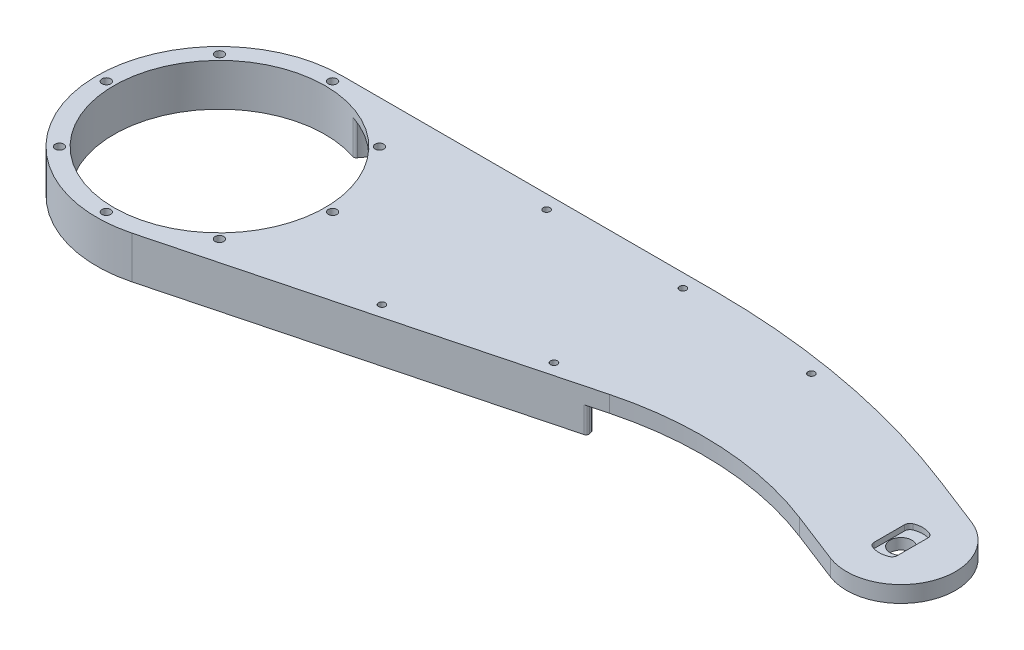
from build123d import *

# Parameters (mm, degrees)
EXTRUDE_1_DEPTH             = 9.500000000000002
EXTRUDE_2_DEPTH             = 115.05569061587602
EXTRUDE_3_DEPTH             = 5.999999999999999
CUT_EXTRUDE_1_DEPTH         = 3.000000000000001
EXTRUDE_4_DEPTH             = 12.5
EXTRUDE_5_DEPTH             = 12.5
EXTRUDE_START               = 12.5
EXTRUDE_6_DEPTH             = 12.5
EXTRUDE_7_DEPTH             = 12.5
CUT_EXTRUDE_2_DEPTH         = 2
HOLE_WIZARD_8_0_8_1_D       = 8
HOLE_WIZARD_8_0_8_1_DEPTH   = 6
HOLE_WIZARD_2_5_2_5_1_D     = 2.5
HOLE_WIZARD_3_2_3_2_1_D     = 3.2
HOLE_WIZARD_3_2_3_2_1_DEPTH = 15.5
HOLE_WIZARD_3_2_3_2_2_D     = 3.2
FILLET_1_R                  = 1
FILLET_2_R                  = 2
FILLET_3_R                  = 120.00000000000003


with BuildPart() as part:
    # Эскиз1 → Бобышка-Вытянуть1 (new body)
    with BuildSketch(Plane.XZ):
        with BuildLine():
            Line((31.779364408196322, 35.09465055833703), (32.53928446481828, 37.996808635931096))
            Line((32.53928446481828, 37.996808635931096), (11.398800849455474, 43.53237116439277))
            ThreePointArc((11.398800849455474, 43.53237116439277), (-44.6315846816897, 5.746446623885336), (0, -45))
            Line((0, -45), (136.6047385645944, -45))
            ThreePointArc((136.6047385645944, -45), (174.0514558866368, -42.49971682694584), (210.833370462018, -35.04325558103525))
            ThreePointArc((210.833370462018, -35.04325558103525), (211.56166337980483, -34.20622038377409), (211.068983168903, -33.2120852293116))
            Line((211.068983168903, -33.2120852293116), (207.14834257891937, -30.95366812818016))
            ThreePointArc((207.14834257891937, -30.95366812818016), (204.26320644859996, -33.162341546064276), (200.87949883001698, -34.4862643192222))
            ThreePointArc((200.87949883001698, -34.4862643192222), (171.45991408687433, -39.811616665453215), (141.6391276395998, -41.95452117487615))
            ThreePointArc((141.6391276395998, -41.95452117487615), (136.9266537788762, -40.870335373727656), (133.2738484900434, -37.7017580492345))
            ThreePointArc((133.2738484900434, -37.7017580492345), (129.99235706441334, -36.0000073018108), (126.71739277340599, -37.7142857142829))
            ThreePointArc((126.71739277340599, -37.7142857142829), (123.13997520578543, -40.86405260427835), (118.5108747069212, -42))
            Line((118.5108747069212, -42), (21.853203426500148, -42))
            ThreePointArc((21.853203426500148, -42), (16.621968089397427, -40.52256867662841), (12.936490941687484, -36.52683536956956))
            ThreePointArc((12.936490941687484, -36.52683536956956), (38.432753475903155, -4.948329037205795), (21.767072161661147, 32.05865046300353))
            ThreePointArc((21.767072161661147, 32.05865046300353), (26.34449721336863, 34.99051102645374), (31.779364408196322, 35.09465055833703))
        make_face()
    extrude(amount=-EXTRUDE_1_DEPTH)

    # Эскиз2 → Бобышка-Вытянуть2 (add)
    with BuildSketch(Plane(origin=(21.140483615362722, 0, -5.535562528461676), x_dir=(-0.2533066855420127, 0, -0.967386025875772), z_dir=(0.9673860258757722, 0, -0.2533066855420127))):
        Polygon((-42.00000000000173, 0), (-45.000000000001705, -8.7e-16), (-45.000000000001705, 9.5), (-42.00000000000173, 9.5), align=None)
    extrude(amount=EXTRUDE_2_DEPTH)

    # Эскиз3 → Бобышка-Вытянуть3 (add)
    with BuildSketch(Plane(origin=(0, 9.500000000000002, 0), x_dir=(-1, 0, 0), z_dir=(0, 1, 0))):
        with BuildLine():
            Line((0, -45), (-136.6047385645944, -45))
            ThreePointArc((-136.6047385645944, -45), (-188.48995572376379, -40.179977983128), (-238.599420052963, -25.88487544631455))
            Line((-238.599420052963, -25.88487544631455), (-257.242147749639, -18.6427276966758))
            ThreePointArc((-257.242147749639, -18.6427276966758), (-268.6427276966758, 7.242147749639007), (-242.757852250361, 18.6427276966758))
            Line((-242.757852250361, 18.6427276966758), (-187.87549846851005, -2.677441830178293))
            Line((-187.87549846851005, -2.677441830178293), (-11.398800849390101, 43.53237116440985))
            ThreePointArc((-11.398800849390101, 43.53237116440985), (44.63158468169398, 5.74644662385182), (0, -45))
        make_face()
    extrude(amount=EXTRUDE_3_DEPTH)

    # Эскиз4 → Вырез-Вытянуть1 (cut)
    with BuildSketch(Plane.XZ.offset(-9.500000000000002)):
        with BuildLine():
            Line((201.174054751897, -9.26076332158908), (31.779364408181, 35.094650558340646))
            ThreePointArc((31.779364408181, 35.094650558340646), (26.344497213361088, 34.99051102645149), (21.767072161661147, 32.05865046300353))
            ThreePointArc((21.767072161661147, 32.05865046300353), (38.432753475903155, -4.9483290372057915), (12.936490941687483, -36.526835369569554))
            ThreePointArc((12.936490941687483, -36.526835369569554), (16.621968089397427, -40.52256867662841), (21.853203426500148, -42))
            Line((21.853203426500148, -42), (118.5108747069212, -42))
            ThreePointArc((118.5108747069212, -42), (123.13997520578546, -40.8640526042784), (126.71739277340599, -37.7142857142829))
            ThreePointArc((126.71739277340599, -37.7142857142829), (129.99235706441334, -36.00000730181071), (133.2738484900434, -37.7017580492345))
            ThreePointArc((133.2738484900434, -37.7017580492345), (136.92665377887585, -40.870335373728324), (141.6391276395998, -41.95452117487615))
            ThreePointArc((141.6391276395998, -41.95452117487615), (171.4599140868743, -39.8116166654531), (200.87949883001698, -34.4862643192222))
            ThreePointArc((200.87949883001698, -34.4862643192222), (210.88018165389494, -21.98857114883415), (201.174054751897, -9.26076332158908))
        make_face()
    extrude(amount=-CUT_EXTRUDE_1_DEPTH, mode=Mode.SUBTRACT)

    # Эскиз5 → Бобышка-Вытянуть4 (add)
    with BuildSketch(Plane.XZ.offset(-12.500000000000002)):
        with BuildLine():
            Line((69.39219411302629, 25.245861169673617), (91.62103262914168, 19.425316674141865))
            ThreePointArc((91.62103262914168, 19.425316674141865), (86.85516242440718, 19.49899914179931), (82.59656164963481, 17.358142454506996))
            ThreePointArc((82.59656164963481, 17.358142454506996), (78.98677325783201, 16.531272766653025), (76.24546493074466, 19.02115516751604))
            ThreePointArc((76.24546493074466, 19.02115516751604), (73.58257817824061, 22.974379428515537), (69.39219411302629, 25.245861169673617))
        make_face()
    extrude(amount=EXTRUDE_4_DEPTH)

    # Эскиз6 → Бобышка-Вытянуть5 (add)
    with BuildSketch(Plane.XZ.offset(-12.500000000000002)):
        with BuildLine():
            Line((119.39219411302322, 12.153534075498996), (141.6210326291386, 6.332989579967239))
            ThreePointArc((141.6210326291386, 6.332989579967239), (136.8551624244041, 6.406672047624693), (132.59656164963178, 4.26581536033236))
            ThreePointArc((132.59656164963178, 4.26581536033236), (128.986773257829, 3.438945672478428), (126.24546493074165, 5.928828073341451))
            ThreePointArc((126.24546493074165, 5.928828073341451), (123.58257817823758, 9.882052334340969), (119.39219411302322, 12.153534075498996))
        make_face()
    extrude(amount=EXTRUDE_5_DEPTH)

    # Эскиз7 → Бобышка-Вытянуть6 (add)
    with BuildSketch(Plane.XZ.offset(-12.500000000000002).offset(EXTRUDE_START)):
        with BuildLine():
            ThreePointArc((169.350540410565, -40.06937238400199), (173.90141926099287, -38.33703307937142), (177.09458850993005, -34.660734951460455))
            ThreePointArc((177.09458850993005, -34.660734951460455), (180.02526915777943, -32.52060975329769), (183.4802160115175, -33.63073008971875))
            ThreePointArc((183.4802160115175, -33.63073008971875), (187.66734322037206, -36.11658276325075), (192.5321018049815, -36.33017511120823))
            ThreePointArc((192.5321018049815, -36.33017511120823), (180.98072250488946, -38.44404700724877), (169.350540410565, -40.06937238400199))
        make_face()
    extrude(amount=-EXTRUDE_6_DEPTH)

    # Эскиз8 → Бобышка-Вытянуть7 (add)
    with BuildSketch(Plane.XZ.offset(-12.500000000000002)):
        with BuildLine():
            Line((91.489125293076, -42), (68.510874706924, -42))
            ThreePointArc((68.510874706924, -42), (73.13997520578674, -40.86405260427919), (76.71739277340684, -37.714285714285715))
            ThreePointArc((76.71739277340684, -37.714285714285715), (80.00000000000003, -36), (83.2826072265932, -37.714285714285765))
            ThreePointArc((83.2826072265932, -37.714285714285765), (86.86002479421332, -40.86405260427916), (91.489125293076, -42))
        make_face()
    extrude(amount=EXTRUDE_7_DEPTH)

    # Эскиз9 → Вырез-Вытянуть2 (cut)
    with BuildSketch(Plane(origin=(0, 15.5, 0), x_dir=(-1, 0, 0), z_dir=(0, 1, 0))):
        with BuildLine():
            Line((-245.75, -6.777720855862977), (-245.75, 6.777720855862977))
            ThreePointArc((-245.75, 6.777720855862977), (-249.99999999999997, 7.999999999999998), (-254.24999999999997, 6.777720855862994))
            Line((-254.24999999999997, 6.777720855862994), (-254.24999999999997, -6.777720855862994))
            ThreePointArc((-254.24999999999997, -6.777720855862994), (-249.99999999999997, -7.999999999999997), (-245.75, -6.777720855862977))
        make_face()
    extrude(amount=-CUT_EXTRUDE_2_DEPTH, mode=Mode.SUBTRACT)

    # Эскиз10 → Вырез-Повернуть1 (revolve, cut)
    with BuildSketch(Plane(origin=(0, 0, 0), x_dir=(-1, 0, 0), z_dir=(0, 0, -1)), mode=Mode.PRIVATE) as cut_revolve_1_sk:
        Polygon((-38.75000000000001, 0), (0, 0), (0, 15.5), (-38.75, 15.5), align=None)
    revolve(cut_revolve_1_sk.sketch.rotate(Axis((0, 0, 0), (0, 1, 0)), 270), axis=Axis((0, 0, 0), (0, 1, 0)), mode=Mode.SUBTRACT)

    # Диаметр отверстия Ø8.0 (8)1
    with Locations(Plane(origin=(0, 9.500000000000002, 0), x_dir=(-1, 0, 0), z_dir=(0, -1, 0))):
        with Locations((-250, 0)):
            Hole(HOLE_WIZARD_8_0_8_1_D / 2, depth=HOLE_WIZARD_8_0_8_1_DEPTH)

    # Диаметр отверстия Ø2.5 (2.5)1 (through all)
    with Locations(Plane(origin=(0, 15.5, 0), x_dir=(1, 0, 0), z_dir=(0, 1, 0))):
        with Locations((130, -7.308489776), (130, 40), (80, -20.40081687), (180.662238056, 36.469567923), (80, 40)):
            Hole(HOLE_WIZARD_2_5_2_5_1_D / 2)

    # Диаметр отверстия Ø3.2 (3.2)1
    with Locations(Plane(origin=(0, 15.5, 0), x_dir=(1, 0, 0), z_dir=(0, 1, 0))):
        with Locations((29.344931419, 29.344931419), (41.5, 0), (29.344931419, -29.344931419)):
            Hole(HOLE_WIZARD_3_2_3_2_1_D / 2, depth=HOLE_WIZARD_3_2_3_2_1_DEPTH)

    # Диаметр отверстия Ø3.2 (3.2)2 (through all)
    with Locations(Plane(origin=(0, 15.5, 0), x_dir=(1, 0, 0), z_dir=(0, 1, 0))):
        with Locations((-29.344931419, 29.344931419), (0, 41.5), (0, -41.5), (-29.344931419, -29.344931419), (-41.5, 0)):
            Hole(HOLE_WIZARD_3_2_3_2_2_D / 2)

    # Скругление1
    fillet_1_edges = [part.edges().sort_by_distance(p)[0] for p in [
        (21.767072161661147, 6.250000000000002, 32.05865046300353),
        (12.936490941687481, 6.250000000000002, -36.526835369569554),
        (207.14834257891937, 4.750000000000001, -30.953668128180162),
        (143.08263170741236, 4.75, 5.95027491566762),
        (143.84255176403838, 4.749999999999999, 8.852432993294912),
    ]]
    fillet(fillet_1_edges, radius=FILLET_1_R)

    # Скругление2
    fillet_2_edges = [part.edges().sort_by_distance(p)[0] for p in [
        (245.75, 14.5, -6.777720855862977),
        (254.24999999999997, 14.5, -6.777720855862994),
        (254.24999999999997, 14.5, 6.777720855862995),
        (245.75, 14.5, 6.7777208558629765),
    ]]
    fillet(fillet_2_edges, radius=FILLET_2_R)

    # Скругление3
    fillet_3_edges = [part.edges().sort_by_distance(p)[0] for p in [
        (187.87549846851005, 12.500000000000002, -2.677441830178293),
    ]]
    fillet(fillet_3_edges, radius=FILLET_3_R)


solid = part.part
